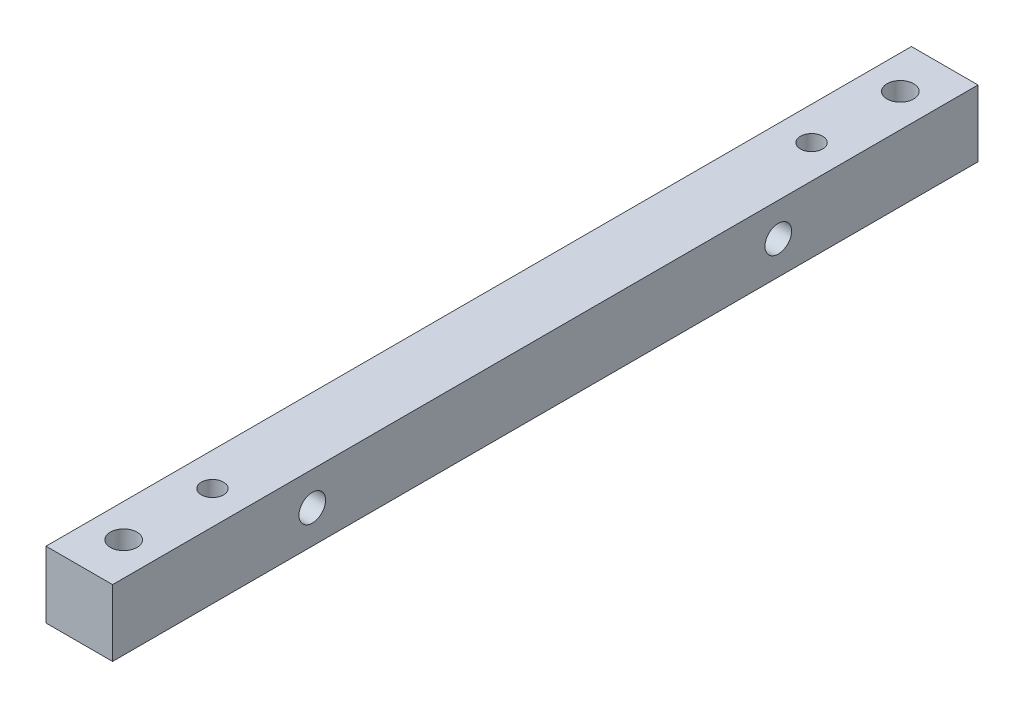
from build123d import *

# Parameters (mm, degrees)
SKETCH_1_W          = 6
SKETCH_1_H          = 6
EXTRUDE_1_DEPTH     = 78
SKETCH_2_R          = 1.2
SKETCH_2_R_2        = 1
CUT_EXTRUDE_1_DEPTH = 80
SKETCH_3_R          = 1.2
CUT_EXTRUDE_2_DEPTH = 80


with BuildPart() as part:
    # 草图1 → 凸台-拉伸1 (new body)
    with BuildSketch(Plane.XY):
        with Locations((3, 3)):
            Rectangle(SKETCH_1_W, SKETCH_1_H)
    extrude(amount=EXTRUDE_1_DEPTH)

    # 草图2 → 切除-拉伸1 (cut)
    with BuildSketch(Plane(origin=(0, 6, 0), x_dir=(1, 0, 0), z_dir=(0, 1, 0))):
        with Locations(Location((3, -74, 0), (0, 0, 270))):
            Circle(SKETCH_2_R)
        with Locations(Location((3, -4, 0), (0, 0, 270))):
            Circle(SKETCH_2_R)
        with Locations(Location((3, -12, 0), (0, 0, 270))):
            Circle(SKETCH_2_R_2)
        with Locations(Location((3, -66, 0), (0, 0, 270))):
            Circle(SKETCH_2_R_2)
    extrude(amount=-CUT_EXTRUDE_1_DEPTH, mode=Mode.SUBTRACT)

    # 草图3 → 切除-拉伸2 (cut)
    with BuildSketch(Plane(origin=(6, 0, 0), x_dir=(0, 0, -1), z_dir=(1, 0, 0))):
        with Locations((-60, 3)):
            Circle(SKETCH_3_R)
        with Locations((-18, 3)):
            Circle(SKETCH_3_R)
    extrude(amount=-CUT_EXTRUDE_2_DEPTH, mode=Mode.SUBTRACT)


solid = part.part
